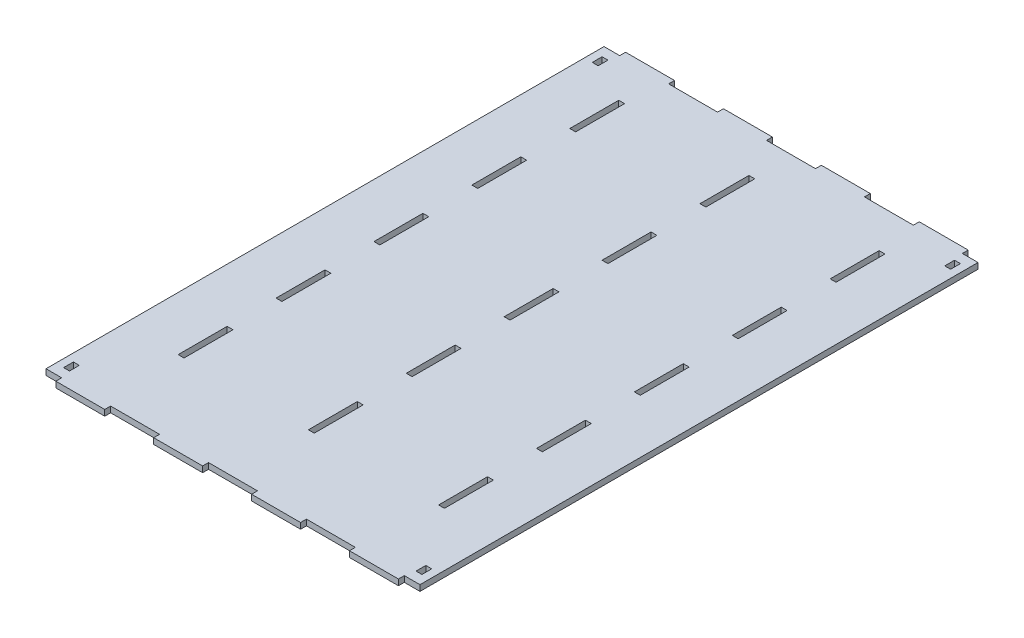
from build123d import *

# Parameters (mm, degrees)
SKICA1_W                 = 191
SKICA1_H                 = 285
P_IDAT_VYSUNUT_M1_DEPTH  = 3
SKICA7_W                 = 25
SKICA7_H                 = 3
P_IDAT_VYSUNUT_M2_DEPTH  = 3
SKICA6_W                 = 3
SKICA6_H                 = 5
ODEBRAT_VYSUNUT_M6_DEPTH = 175.067515637
SKICA4_W                 = 3
SKICA4_H                 = 25
ODEBRAT_VYSUNUT_M3_DEPTH = 175.067515637


with BuildPart() as part:
    # Skica1 → Přidat vysunutím1 (new body)
    with BuildSketch(Plane(origin=(0, 0, 0), x_dir=(1, 0, 0), z_dir=(0, 1, 0))):
        Rectangle(SKICA1_W, SKICA1_H)
    extrude(amount=P_IDAT_VYSUNUT_M1_DEPTH)

    # Skica7 → Přidat vysunutím2 (add)
    with BuildSketch(Plane(origin=(0, 0, 0), x_dir=(1, 0, 0), z_dir=(0, 1, 0))):
        with Locations((-75, -144)):
            Rectangle(SKICA7_W, SKICA7_H)
        with Locations((-25, -144)):
            Rectangle(SKICA7_W, SKICA7_H)
        with Locations((25, -144)):
            Rectangle(SKICA7_W, SKICA7_H)
        with Locations((75, -144)):
            Rectangle(SKICA7_W, SKICA7_H)
        with Locations((75, 144)):
            Rectangle(SKICA7_W, SKICA7_H)
        with Locations((25, 144)):
            Rectangle(SKICA7_W, SKICA7_H)
        with Locations((-25, 144)):
            Rectangle(SKICA7_W, SKICA7_H)
        with Locations((-75, 144)):
            Rectangle(SKICA7_W, SKICA7_H)
    extrude(amount=P_IDAT_VYSUNUT_M2_DEPTH)

    # Skica6 → Odebrat vysunutím6 (cut, through all)
    with BuildSketch(Plane(origin=(0, 0, 0), x_dir=(1, 0, 0), z_dir=(0, 1, 0))):
        with Locations((-90, -135)):
            Rectangle(SKICA6_W, SKICA6_H)
        with Locations((90, -135)):
            Rectangle(SKICA6_W, SKICA6_H)
        with Locations((90, 135)):
            Rectangle(SKICA6_W, SKICA6_H)
        with Locations((-90, 135)):
            Rectangle(SKICA6_W, SKICA6_H)
    extrude(amount=ODEBRAT_VYSUNUT_M6_DEPTH, mode=Mode.SUBTRACT)

    # Skica4 → Odebrat vysunutím3 (cut, through all)
    with BuildSketch(Plane(origin=(0, 0, 0), x_dir=(1, 0, 0), z_dir=(0, 1, 0))):
        with Locations((-66.5, 110)):
            Rectangle(SKICA4_W, SKICA4_H)
        with Locations((0, 110)):
            Rectangle(SKICA4_W, SKICA4_H)
        with Locations((66.5, 110)):
            Rectangle(SKICA4_W, SKICA4_H)
        with Locations((66.5, 60)):
            Rectangle(SKICA4_W, SKICA4_H)
        with Locations((0, 60)):
            Rectangle(SKICA4_W, SKICA4_H)
        with Locations((-66.5, 60)):
            Rectangle(SKICA4_W, SKICA4_H)
        with Locations((66.5, 10)):
            Rectangle(SKICA4_W, SKICA4_H)
        with Locations((0, 10)):
            Rectangle(SKICA4_W, SKICA4_H)
        with Locations((-66.5, 10)):
            Rectangle(SKICA4_W, SKICA4_H)
        with Locations((66.5, -40)):
            Rectangle(SKICA4_W, SKICA4_H)
        with Locations((0, -40)):
            Rectangle(SKICA4_W, SKICA4_H)
        with Locations((-66.5, -40)):
            Rectangle(SKICA4_W, SKICA4_H)
        with Locations((66.5, -90)):
            Rectangle(SKICA4_W, SKICA4_H)
        with Locations((0, -90)):
            Rectangle(SKICA4_W, SKICA4_H)
        with Locations((-66.5, -90)):
            Rectangle(SKICA4_W, SKICA4_H)
    extrude(amount=ODEBRAT_VYSUNUT_M3_DEPTH, mode=Mode.SUBTRACT)


solid = part.part
